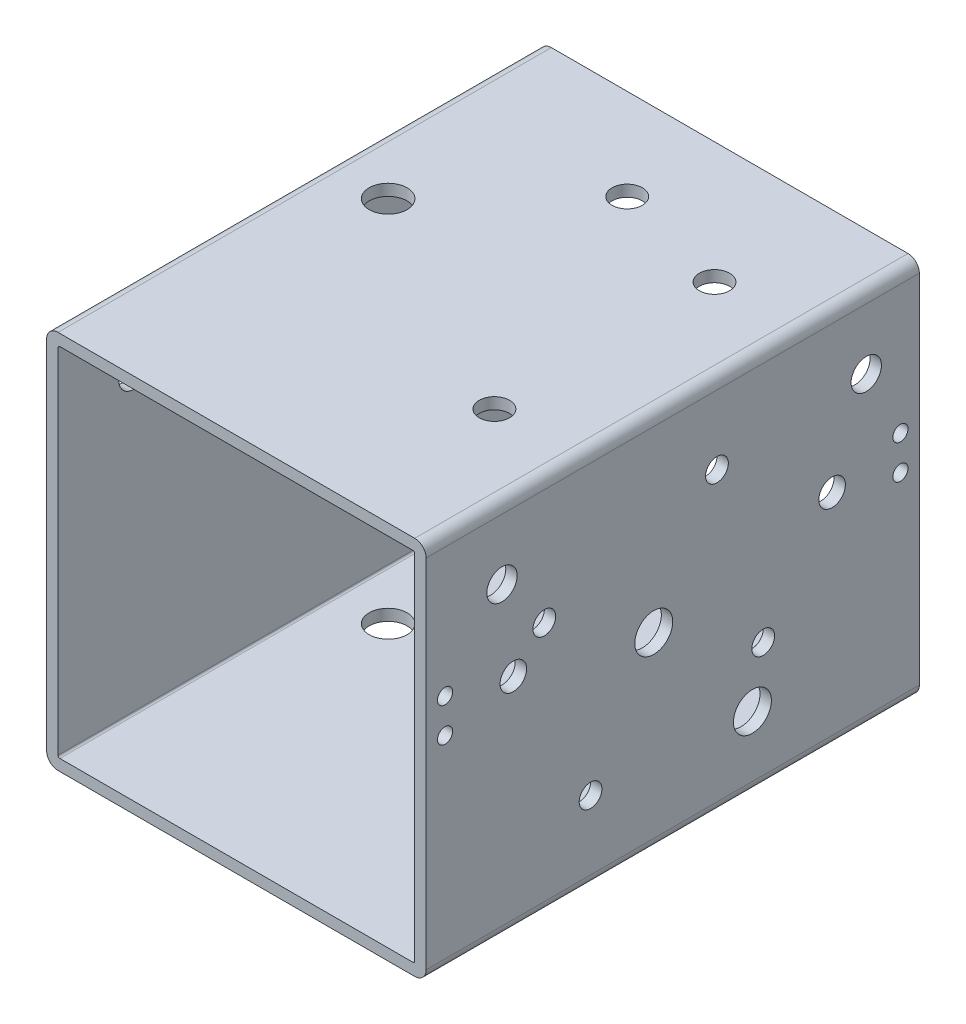
from build123d import *

# Parameters (mm, degrees)
SKETCH1_W                      = 100
SKETCH1_H                      = 100
SKETCH1_W_2                    = 94
SKETCH1_H_2                    = 94
EXTRUDE_THIN1_DEPTH            = 130
FILLET1_R                      = 0.5
FILLET2_R                      = 3
F_8_0_8_DIAMETER_HOLE2_D       = 8
F_8_0_8_DIAMETER_HOLE3_D       = 8
F_10_0_10_DIAMETER_HOLE1_D     = 10
F_10_0_10_DIAMETER_HOLE2_D     = 10
M8X1_25_TAPPED_HOLE1_D         = 6.8
M8X1_25_TAPPED_HOLE1_DEPTH     = 3
M8X1_25_TAPPED_HOLE2_D         = 6.8
M8X1_25_TAPPED_HOLE2_DEPTH     = 3
F_10_0_10_DIAMETER_HOLE3_D     = 10
F_10_0_10_DIAMETER_HOLE3_DEPTH = 3
F_6_0_6_DIAMETER_HOLE1_D       = 6
F_6_0_6_DIAMETER_HOLE1_DEPTH   = 3
F_8_0_8_DIAMETER_HOLE4_D       = 8
F_8_0_8_DIAMETER_HOLE4_DEPTH   = 3
CUT_EXTRUDE1_REACH             = 173.464
SKETCH31_R                     = 2
SKETCH31_R_2                   = 3.5


with BuildPart() as part:
    # Sketch1 → Extrude-Thin1 (new body)
    with BuildSketch(Plane.XY):
        Rectangle(SKETCH1_W, SKETCH1_H)
        Rectangle(SKETCH1_W_2, SKETCH1_H_2, mode=Mode.SUBTRACT)
    extrude(amount=EXTRUDE_THIN1_DEPTH)

    # Fillet1
    fillet1_edges = [part.edges().sort_by_distance(p)[0] for p in [
        (47, -47, 65),
        (47, 47, 65),
        (-47, 47, 65),
        (-47, -47, 65),
    ]]
    fillet(fillet1_edges, radius=FILLET1_R)

    # Fillet2
    fillet2_edges = [part.edges().sort_by_distance(p)[0] for p in [
        (50, -50, 65),
        (-50, -50, 65),
        (-50, 50, 65),
        (50, 50, 65),
    ]]
    fillet(fillet2_edges, radius=FILLET2_R)

    # Ø8.0 (8) Diameter Hole2 (through all)
    with Locations(Plane(origin=(0, 50, 0), x_dir=(1, 0, 0), z_dir=(0, 1, 0))):
        with Locations((28, -32), (28, -90)):
            Hole(F_8_0_8_DIAMETER_HOLE2_D / 2)

    # Ø8.0 (8) Diameter Hole3 (through all)
    with Locations(Plane(origin=(50, 0, 0), x_dir=(0, 0, -1), z_dir=(1, 0, 0))):
        with Locations((-14, 31), (-110, 31)):
            Hole(F_8_0_8_DIAMETER_HOLE3_D / 2)

    # Ø10.0 (10) Diameter Hole1 (through all)
    with Locations(Plane(origin=(0, 50, 0), x_dir=(1, 0, 0), z_dir=(0, 1, 0))):
        with Locations((-34, -56)):
            Hole(F_10_0_10_DIAMETER_HOLE1_D / 2)

    # Ø10.0 (10) Diameter Hole2 (through all)
    with Locations(Plane(origin=(50, 0, 0), x_dir=(0, 0, -1), z_dir=(1, 0, 0))):
        with Locations((-44, -31)):
            Hole(F_10_0_10_DIAMETER_HOLE2_D / 2)

    # M8x1.25 Tapped Hole1
    with Locations(Plane.ZY.offset(50)):
        with Locations((56, -15), (56, 35)):
            Hole(M8X1_25_TAPPED_HOLE1_D / 2, depth=M8X1_25_TAPPED_HOLE1_DEPTH)

    # M8x1.25 Tapped Hole2
    with Locations(Plane(origin=(0, -50, 0), x_dir=(-1, 0, 0), z_dir=(0, -1, 0))):
        with Locations((20, -44), (-35, -44)):
            Hole(M8X1_25_TAPPED_HOLE2_D / 2, depth=M8X1_25_TAPPED_HOLE2_DEPTH)

    # Ø10.0 (10) Diameter Hole3
    with Locations(Plane(origin=(50, 0, 0), x_dir=(0, 0, -1), z_dir=(1, 0, 0))):
        with Locations((-70, 0)):
            Hole(F_10_0_10_DIAMETER_HOLE3_D / 2, depth=F_10_0_10_DIAMETER_HOLE3_DEPTH)

    # Ø6.0 (6) Diameter Hole1
    with Locations(Plane(origin=(50, 0, 0), x_dir=(0, 0, -1), z_dir=(1, 0, 0))):
        with Locations((-41.157258279, -16.652364697), (-53.347635303, 28.842741721), (-98.842741721, 16.652364697), (-86.652364697, -28.842741721)):
            Hole(F_6_0_6_DIAMETER_HOLE1_D / 2, depth=F_6_0_6_DIAMETER_HOLE1_DEPTH)

    # Ø8.0 (8) Diameter Hole4
    with Locations(Plane(origin=(0, 50, 0), x_dir=(1, 0, 0), z_dir=(0, 1, 0))):
        with Locations((-3, -24)):
            Hole(F_8_0_8_DIAMETER_HOLE4_D / 2, depth=F_8_0_8_DIAMETER_HOLE4_DEPTH)

    # Sketch31 → Cut-Extrude1 (cut, up to next)
    with BuildSketch(Plane(origin=(50, 0, 0), x_dir=(0, 0, -1), z_dir=(1, 0, 0)), mode=Mode.PRIVATE) as cut_extrude1_sk1:
        with Locations(Location((-5, 4, 0), (0, 0, 90))):
            Circle(SKETCH31_R)
    cut_extrude1_tool1 = extrude(cut_extrude1_sk1.sketch, amount=-CUT_EXTRUDE1_REACH, mode=Mode.PRIVATE) & part.part
    # Sketch31 → Cut-Extrude1 (cut, up to next)
    with BuildSketch(Plane(origin=(50, 0, 0), x_dir=(0, 0, -1), z_dir=(1, 0, 0)), mode=Mode.PRIVATE) as cut_extrude1_sk2:
        with Locations(Location((-5, 13, 0), (0, 0, 90))):
            Circle(SKETCH31_R)
    cut_extrude1_tool2 = extrude(cut_extrude1_sk2.sketch, amount=-CUT_EXTRUDE1_REACH, mode=Mode.PRIVATE) & part.part
    # Sketch31 → Cut-Extrude1 (cut, up to next)
    with BuildSketch(Plane(origin=(50, 0, 0), x_dir=(0, 0, -1), z_dir=(1, 0, 0)), mode=Mode.PRIVATE) as cut_extrude1_sk3:
        with Locations(Location((-125, 13, 0), (0, 0, 90))):
            Circle(SKETCH31_R)
    cut_extrude1_tool3 = extrude(cut_extrude1_sk3.sketch, amount=-CUT_EXTRUDE1_REACH, mode=Mode.PRIVATE) & part.part
    # Sketch31 → Cut-Extrude1 (cut, up to next)
    with BuildSketch(Plane(origin=(50, 0, 0), x_dir=(0, 0, -1), z_dir=(1, 0, 0)), mode=Mode.PRIVATE) as cut_extrude1_sk4:
        with Locations(Location((-125, 4, 0), (0, 0, 90))):
            Circle(SKETCH31_R)
    cut_extrude1_tool4 = extrude(cut_extrude1_sk4.sketch, amount=-CUT_EXTRUDE1_REACH, mode=Mode.PRIVATE) & part.part
    # Sketch31 → Cut-Extrude1 (cut, up to next)
    with BuildSketch(Plane(origin=(50, 0, 0), x_dir=(0, 0, -1), z_dir=(1, 0, 0)), mode=Mode.PRIVATE) as cut_extrude1_sk5:
        with Locations(Location((-23, 8.5, 0), (0, 0, 90))):
            Circle(SKETCH31_R_2)
    cut_extrude1_tool5 = extrude(cut_extrude1_sk5.sketch, amount=-CUT_EXTRUDE1_REACH, mode=Mode.PRIVATE) & part.part
    # Sketch31 → Cut-Extrude1 (cut, up to next)
    with BuildSketch(Plane(origin=(50, 0, 0), x_dir=(0, 0, -1), z_dir=(1, 0, 0)), mode=Mode.PRIVATE) as cut_extrude1_sk6:
        with Locations(Location((-107, 8.5, 0), (0, 0, 90))):
            Circle(SKETCH31_R_2)
    cut_extrude1_tool6 = extrude(cut_extrude1_sk6.sketch, amount=-CUT_EXTRUDE1_REACH, mode=Mode.PRIVATE) & part.part
    add(cut_extrude1_tool1.solids().sort_by_distance((50, 4, 5))[0], mode=Mode.SUBTRACT)
    add(cut_extrude1_tool2.solids().sort_by_distance((50, 13, 5))[0], mode=Mode.SUBTRACT)
    add(cut_extrude1_tool3.solids().sort_by_distance((50, 13, 125))[0], mode=Mode.SUBTRACT)
    add(cut_extrude1_tool4.solids().sort_by_distance((50, 4, 125))[0], mode=Mode.SUBTRACT)
    add(cut_extrude1_tool5.solids().sort_by_distance((50, 8.5, 23))[0], mode=Mode.SUBTRACT)
    add(cut_extrude1_tool6.solids().sort_by_distance((50, 8.5, 107))[0], mode=Mode.SUBTRACT)


solid = part.part
